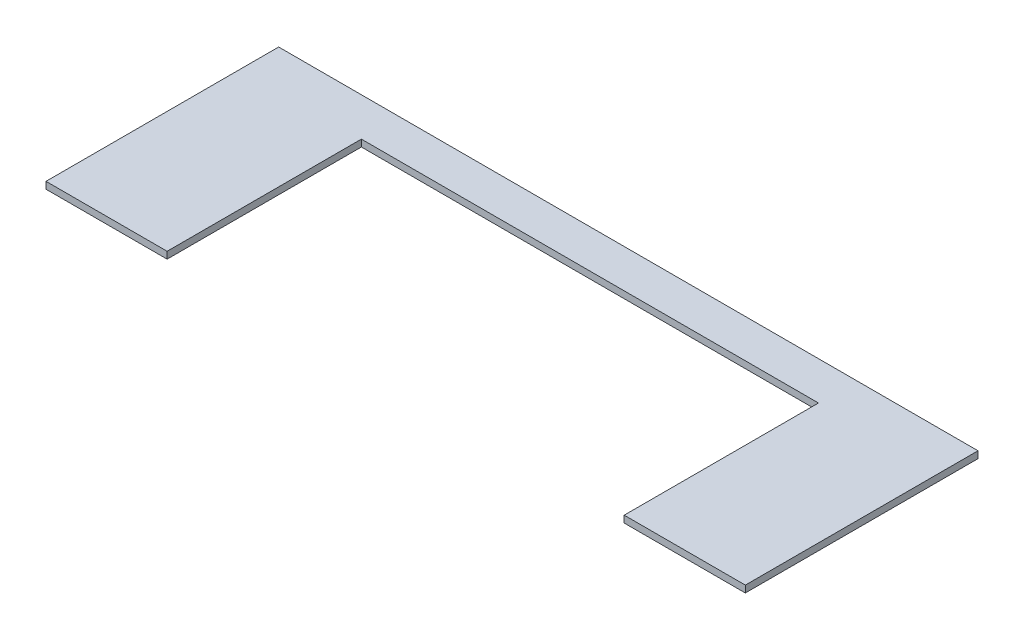
from build123d import *

# Parameters (mm, degrees)
SKETCH_1_W          = 612
SKETCH_1_H          = 203.607233597
EXTRUDE_1_DEPTH     = 6
SKETCH_2_W          = 400
SKETCH_2_H          = 170
CUT_EXTRUDE_1_DEPTH = 6


with BuildPart() as part:
    # Эскиз1 → Бобышка-Вытянуть1 (new body)
    with BuildSketch(Plane(origin=(0, 0, 0), x_dir=(1, 0, 0), z_dir=(0, 1, 0))):
        with Locations((2273.061228943, 1972.700687166)):
            Rectangle(SKETCH_1_W, SKETCH_1_H)
    extrude(amount=EXTRUDE_1_DEPTH)

    # Эскиз2 → Вырез-Вытянуть1 (cut)
    with BuildSketch(Plane(origin=(0, 6, 0), x_dir=(1, 0, 0), z_dir=(0, 1, 0))):
        with Locations((2273.061228943, 1955.897070367)):
            Rectangle(SKETCH_2_W, SKETCH_2_H)
    extrude(amount=-CUT_EXTRUDE_1_DEPTH, mode=Mode.SUBTRACT)


solid = part.part
